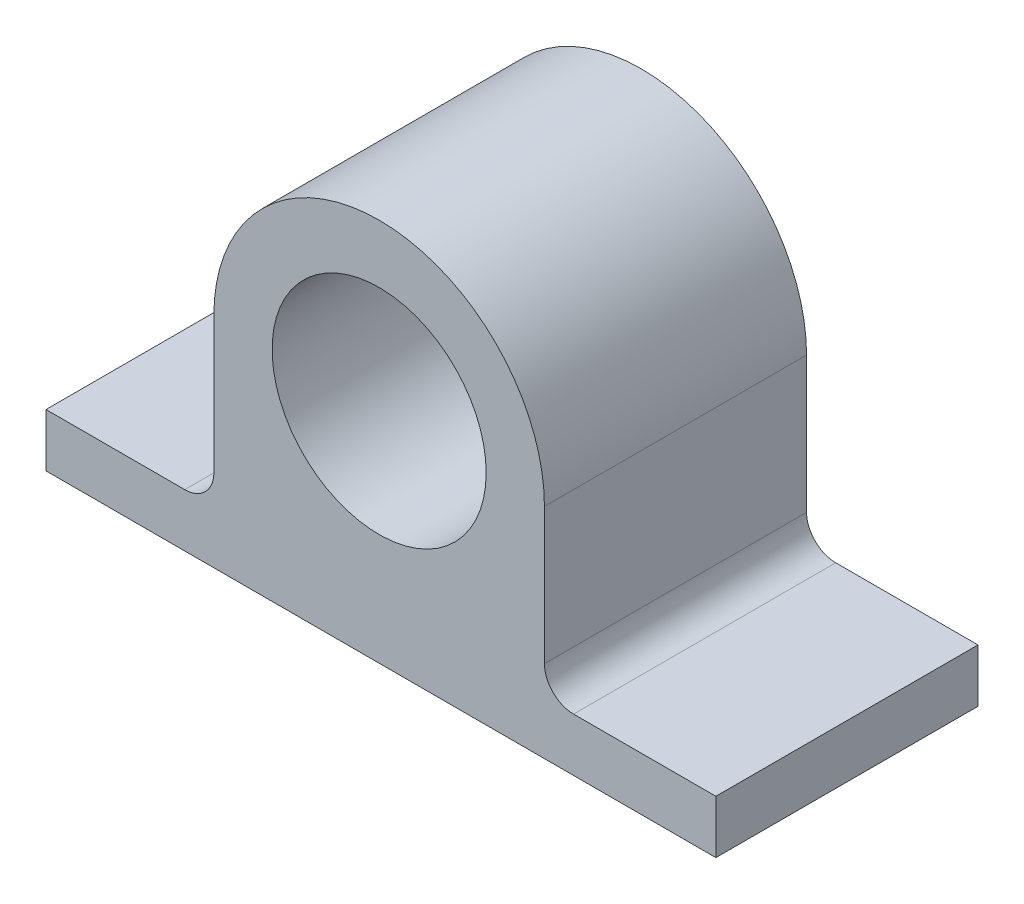
from build123d import *

# Parameters (mm, degrees)
SKETCH1_W           = 23
SKETCH1_H           = 9
BOSS_EXTRUDE1_DEPTH = 15
SKETCH2_W           = 5.763626661
SKETCH2_H           = 7.5
SKETCH2_W_2         = 5.886373339
SKETCH2_H_2         = 5.675
CUT_EXTRUDE1_DEPTH  = 29.896366554
FILLET1_R           = 1


with BuildPart() as part:
    # Sketch1 → Boss-Extrude1 (new body)
    with BuildSketch(Plane(origin=(0, 0, 0), x_dir=(1, 0, 0), z_dir=(0, 1, 0))):
        with Locations((11.5, 4.5)):
            Rectangle(SKETCH1_W, SKETCH1_H)
    extrude(amount=BOSS_EXTRUDE1_DEPTH)

    # Sketch2 → Cut-Extrude1 (cut, through all)
    with BuildSketch(Plane.XY):
        with Locations((2.88181333, 11.25)):
            Rectangle(SKETCH2_W, SKETCH2_H)
        with BuildLine():
            Line((17.113626661, 15), (5.763626661, 15))
            Line((5.763626661, 15), (5.763626661, 7.5))
            ThreePointArc((5.763626661, 7.5), (11.438626661, 13.175), (17.113626661, 7.5))
            Line((17.113626661, 7.5), (17.113626661, 15))
        make_face()
        with Locations((20.05681333, 11.25)):
            Rectangle(SKETCH2_W_2, SKETCH2_H)
        with BuildLine():
            ThreePointArc((15.113626661, 7.5), (11.438626661, 11.175), (7.763626661, 7.5))
            Line((7.763626661, 7.5), (15.113626661, 7.5))
        make_face()
        with BuildLine():
            Line((15.113626661, 7.5), (7.763626661, 7.5))
            ThreePointArc((7.763626661, 7.5), (11.438626661, 3.825), (15.113626661, 7.5))
        make_face()
        with BuildLine():
            ThreePointArc((15.113626661, 7.5), (11.438626661, 11.175), (7.763626661, 7.5))
            Line((7.763626661, 7.5), (15.113626661, 7.5))
        make_face()
        with BuildLine():
            Line((15.113626661, 7.5), (7.763626661, 7.5))
            ThreePointArc((7.763626661, 7.5), (11.438626661, 3.825), (15.113626661, 7.5))
        make_face()
        with Locations((2.88181333, 4.6625)):
            Rectangle(SKETCH2_W, SKETCH2_H_2)
        with Locations((20.05681333, 4.6625)):
            Rectangle(SKETCH2_W_2, SKETCH2_H_2)
    extrude(amount=-CUT_EXTRUDE1_DEPTH, mode=Mode.SUBTRACT)

    # Fillet1
    fillet1_edges = [part.edges().sort_by_distance(p)[0] for p in [
        (17.113626661, 1.825, -4.5),
        (5.763626661, 1.825, -4.5),
    ]]
    fillet(fillet1_edges, radius=FILLET1_R)


solid = part.part
